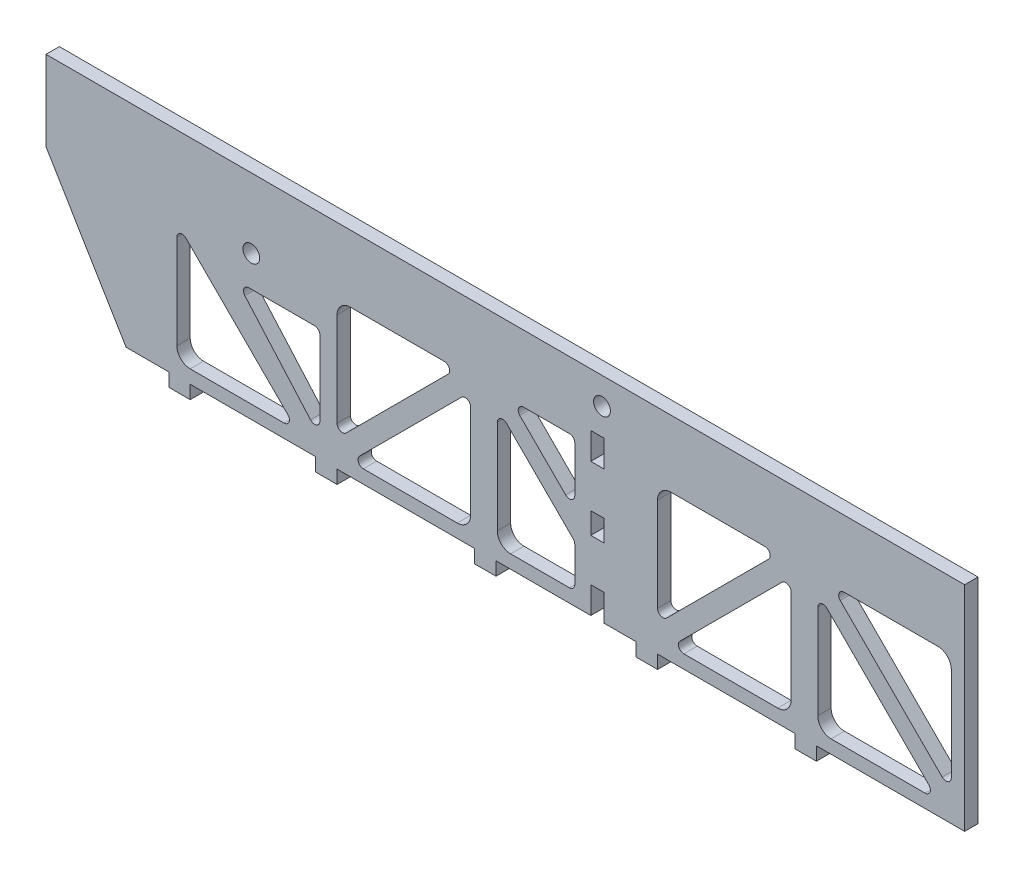
from build123d import *

# Parameters (mm, degrees)
MODEL_R             = 4
BOSS_EXTRUDE1_DEPTH = 6.35
SKETCH1_W           = 10.16
SKETCH1_H           = 6.35
SKETCH1_W_2         = 436.88
BOSS_EXTRUDE2_DEPTH = 6.35
SKETCH2_W           = 6.35
SKETCH2_H           = 10.16
BOSS_EXTRUDE3_DEPTH = 6.35
SKETCH2_3_W         = 6.35
SKETCH2_3_H         = 6.35
SKETCH2_3_H_2       = 12.7
CUT_EXTRUDE1_DEPTH  = 6.35
SKETCH3_W           = 12.986644794
SKETCH3_H           = 59.111624581
BOSS_EXTRUDE4_DEPTH = 6.35
BOSS_EXTRUDE6_DEPTH = 6.35


with BuildPart() as part:
    # Model → Boss-Extrude1 (new body)
    with BuildSketch(Plane.XY):
        Polygon((-398.78, 0), (-436.88, 63.5), (-436.88, 95.25), (0, 95.25), (0, 0), align=None)
        with Locations((-172.466, 88.9)):
            Circle(MODEL_R, mode=Mode.SUBTRACT)
        with Locations((-339.23478, 68.423282)):
            Circle(MODEL_R, mode=Mode.SUBTRACT)
        with BuildLine():
            Line((-306.628052638, 15.624984002), (-306.628052638, 51.149330332))
            ThreePointArc((-306.628052638, 51.149330332), (-307.372001413, 52.945381557), (-309.168052638, 53.689330332))
            Line((-309.168052638, 53.689330332), (-340.406029433, 53.689330332))
            ThreePointArc((-340.406029433, 53.689330332), (-342.720322456, 52.196062295), (-342.31346603, 49.472045137))
            Line((-342.31346603, 49.472045137), (-311.075489235, 13.947698807))
            ThreePointArc((-311.075489235, 13.947698807), (-308.271751616, 13.248380443), (-306.628052638, 15.624984002))
        make_face(mode=Mode.SUBTRACT)
        with BuildLine():
            Line((-171.232102448, 6.35), (-215.9, 6.35))
            ThreePointArc((-215.9, 6.35), (-220.390128061, 8.209871939), (-222.25, 12.7))
            Line((-222.25, 12.7), (-222.25, 57.367897552))
            ThreePointArc((-222.25, 57.367897552), (-220.682015918, 59.714551564), (-217.913948776, 59.163948776))
            Line((-217.913948776, 59.163948776), (-169.436051224, 10.686051224))
            ThreePointArc((-169.436051224, 10.686051224), (-168.885448436, 7.917984082), (-171.232102448, 6.35))
        make_face(mode=Mode.SUBTRACT)
        with BuildLine():
            Line((-234.95, 57.367897552), (-234.95, 12.7))
            ThreePointArc((-234.95, 12.7), (-236.809871939, 8.209871939), (-241.3, 6.35))
            Line((-241.3, 6.35), (-285.967897552, 6.35))
            ThreePointArc((-285.967897552, 6.35), (-288.314551564, 7.917984082), (-287.763948776, 10.686051224))
            Line((-287.763948776, 10.686051224), (-239.286051224, 59.163948776))
            ThreePointArc((-239.286051224, 59.163948776), (-236.517984082, 59.714551564), (-234.95, 57.367897552))
        make_face(mode=Mode.SUBTRACT)
        with BuildLine():
            Line((-294.113948776, 17.036051224), (-245.636051224, 65.513948776))
            ThreePointArc((-245.636051224, 65.513948776), (-245.085448436, 68.282015918), (-247.432102448, 69.85))
            Line((-247.432102448, 69.85), (-292.1, 69.85))
            ThreePointArc((-292.1, 69.85), (-296.590128061, 67.990128061), (-298.45, 63.5))
            Line((-298.45, 63.5), (-298.45, 18.832102448))
            ThreePointArc((-298.45, 18.832102448), (-296.882015918, 16.485448436), (-294.113948776, 17.036051224))
        make_face(mode=Mode.SUBTRACT)
        with BuildLine():
            Line((-323.632102448, 6.35), (-368.3, 6.35))
            ThreePointArc((-368.3, 6.35), (-372.790128061, 8.209871939), (-374.65, 12.7))
            Line((-374.65, 12.7), (-374.65, 57.367897552))
            ThreePointArc((-374.65, 57.367897552), (-373.082015918, 59.714551564), (-370.313948776, 59.163948776))
            Line((-370.313948776, 59.163948776), (-321.836051224, 10.686051224))
            ThreePointArc((-321.836051224, 10.686051224), (-321.285448436, 7.917984082), (-323.632102448, 6.35))
        make_face(mode=Mode.SUBTRACT)
        with BuildLine():
            Line((-18.832102448, 6.35), (-63.5, 6.35))
            ThreePointArc((-63.5, 6.35), (-67.990128061, 8.209871939), (-69.85, 12.7))
            Line((-69.85, 12.7), (-69.85, 57.367897552))
            ThreePointArc((-69.85, 57.367897552), (-68.282015918, 59.714551564), (-65.513948776, 59.163948776))
            Line((-65.513948776, 59.163948776), (-17.036051224, 10.686051224))
            ThreePointArc((-17.036051224, 10.686051224), (-16.485448436, 7.917984082), (-18.832102448, 6.35))
        make_face(mode=Mode.SUBTRACT)
        with BuildLine():
            Line((-82.55, 57.367897552), (-82.55, 12.7))
            ThreePointArc((-82.55, 12.7), (-84.409871939, 8.209871939), (-88.9, 6.35))
            Line((-88.9, 6.35), (-133.567897552, 6.35))
            ThreePointArc((-133.567897552, 6.35), (-135.914551564, 7.917984082), (-135.363948776, 10.686051224))
            Line((-135.363948776, 10.686051224), (-86.886051224, 59.163948776))
            ThreePointArc((-86.886051224, 59.163948776), (-84.117984082, 59.714551564), (-82.55, 57.367897552))
        make_face(mode=Mode.SUBTRACT)
        with BuildLine():
            Line((-93.236051224, 65.513948776), (-141.713948776, 17.036051224))
            ThreePointArc((-141.713948776, 17.036051224), (-144.482015918, 16.485448436), (-146.05, 18.832102448))
            Line((-146.05, 18.832102448), (-146.05, 63.5))
            ThreePointArc((-146.05, 63.5), (-144.190128061, 67.990128061), (-139.7, 69.85))
            Line((-139.7, 69.85), (-95.032102448, 69.85))
            ThreePointArc((-95.032102448, 69.85), (-92.685448436, 68.282015918), (-93.236051224, 65.513948776))
        make_face(mode=Mode.SUBTRACT)
        with BuildLine():
            Line((-163.086051224, 17.036051224), (-211.563948776, 65.513948776))
            ThreePointArc((-211.563948776, 65.513948776), (-212.114551564, 68.282015918), (-209.767897552, 69.85))
            Line((-209.767897552, 69.85), (-165.1, 69.85))
            ThreePointArc((-165.1, 69.85), (-160.609871939, 67.990128061), (-158.75, 63.5))
            Line((-158.75, 63.5), (-158.75, 18.832102448))
            ThreePointArc((-158.75, 18.832102448), (-160.317984082, 16.485448436), (-163.086051224, 17.036051224))
        make_face(mode=Mode.SUBTRACT)
        with BuildLine():
            Line((-6.35, 63.5), (-6.35, 18.832102448))
            ThreePointArc((-6.35, 18.832102448), (-7.917984082, 16.485448436), (-10.686051224, 17.036051224))
            Line((-10.686051224, 17.036051224), (-59.163948776, 65.513948776))
            ThreePointArc((-59.163948776, 65.513948776), (-59.714551564, 68.282015918), (-57.367897552, 69.85))
            Line((-57.367897552, 69.85), (-12.7, 69.85))
            ThreePointArc((-12.7, 69.85), (-8.209871939, 67.990128061), (-6.35, 63.5))
        make_face(mode=Mode.SUBTRACT)
    extrude(amount=BOSS_EXTRUDE1_DEPTH)

    # Sketch1 → Boss-Extrude2 (add)
    with BuildSketch(Plane.XY.offset(6.35)):
        with Locations((-75.565, -3.175)):
            Rectangle(SKETCH1_W, SKETCH1_H)
        with Locations((-151.13, -3.175)):
            Rectangle(SKETCH1_W, SKETCH1_H)
        with Locations((-227.965, -3.175)):
            Rectangle(SKETCH1_W, SKETCH1_H)
        with Locations((-303.53, -3.175)):
            Rectangle(SKETCH1_W, SKETCH1_H)
        with Locations((-373.38, -3.175)):
            Rectangle(SKETCH1_W, SKETCH1_H)
        with Locations((-218.44, 98.425)):
            Rectangle(SKETCH1_W_2, SKETCH1_H)
    extrude(amount=-BOSS_EXTRUDE2_DEPTH)

    # Sketch2 → Boss-Extrude3 (add)
    # profile 1 of 3: a face of its own
    with BuildSketch(Plane(origin=(0, 0, 0), x_dir=(-1, 0, 0), z_dir=(0, 0, -1))):
        Polygon((185.42, 39.37), (185.42, 69.85), (177.8, 69.85), (177.8, 63.5), (171.45, 63.5), (171.45, 69.85), (165.1, 69.85), (165.1, 19.05), align=None)
        with Locations((174.625, 38.1)):
            Rectangle(SKETCH2_W, SKETCH2_H, mode=Mode.SUBTRACT)
    # profile 2 of 3: a face of its own
    with BuildSketch(Plane(origin=(0, 0, 0), x_dir=(-1, 0, 0), z_dir=(0, 0, -1))):
        Polygon((185.42, 6.35), (185.42, 26.67), (171.45, 12.7), (177.8, 12.7), (177.8, 6.35), align=None)
    # profile 3 of 3: a face of its own
    with BuildSketch(Plane(origin=(0, 0, 0), x_dir=(-1, 0, 0), z_dir=(0, 0, -1))):
        with BuildLine():
            Line((171.45, 6.35), (171.45, 12.7))
            Line((171.45, 12.7), (169.436051224, 10.686051224))
            ThreePointArc((169.436051224, 10.686051224), (168.885448436, 7.917984082), (171.232102448, 6.35))
            Line((171.232102448, 6.35), (171.45, 6.35))
        make_face()
    extrude(amount=-BOSS_EXTRUDE3_DEPTH)

    # Sketch2<3> → Cut-Extrude1 (cut)
    with BuildSketch(Plane(origin=(0, 0, 0), x_dir=(-1, 0, 0), z_dir=(0, 0, -1))):
        with Locations((174.625, 73.025)):
            Rectangle(SKETCH2_3_W, SKETCH2_3_H)
        with Locations((174.625, 6.35)):
            Rectangle(SKETCH2_3_W, SKETCH2_3_H_2)
    extrude(amount=-CUT_EXTRUDE1_DEPTH, mode=Mode.SUBTRACT)

    # Sketch3 → Boss-Extrude4 (add)
    with BuildSketch(Plane(origin=(0, 0, 0), x_dir=(-1, 0, 0), z_dir=(0, 0, -1))):
        with Locations((160.895729101, 43.146846623)):
            Rectangle(SKETCH3_W, SKETCH3_H)
    extrude(amount=-BOSS_EXTRUDE4_DEPTH)

    # Sketch4 → Boss-Extrude6 (add)
    with BuildSketch(Plane.XY.offset(6.35)):
        with BuildLine():
            ThreePointArc((-187.96, 6.35), (-186.163948776, 7.093948776), (-185.42, 8.89))
            Line((-185.42, 8.89), (-185.42, 6.35))
            Line((-185.42, 6.35), (-187.96, 6.35))
        make_face()
        with BuildLine():
            Line((-185.42, 26.67), (-186.163948776, 27.413948776))
            ThreePointArc((-186.163948776, 27.413948776), (-185.613345987, 26.58991347), (-185.42, 25.617897552))
            Line((-185.42, 25.617897552), (-185.42, 26.67))
        make_face()
        with BuildLine():
            Line((-185.42, 45.502102448), (-185.42, 39.37))
            Line((-185.42, 39.37), (-189.756051224, 43.706051224))
            ThreePointArc((-189.756051224, 43.706051224), (-186.987984082, 43.155448436), (-185.42, 45.502102448))
        make_face()
        with BuildLine():
            Line((-187.96, 69.85), (-185.42, 69.85))
            Line((-185.42, 69.85), (-185.42, 67.31))
            ThreePointArc((-185.42, 67.31), (-186.163948776, 69.106051224), (-187.96, 69.85))
        make_face()
    extrude(amount=-BOSS_EXTRUDE6_DEPTH)


solid = part.part
